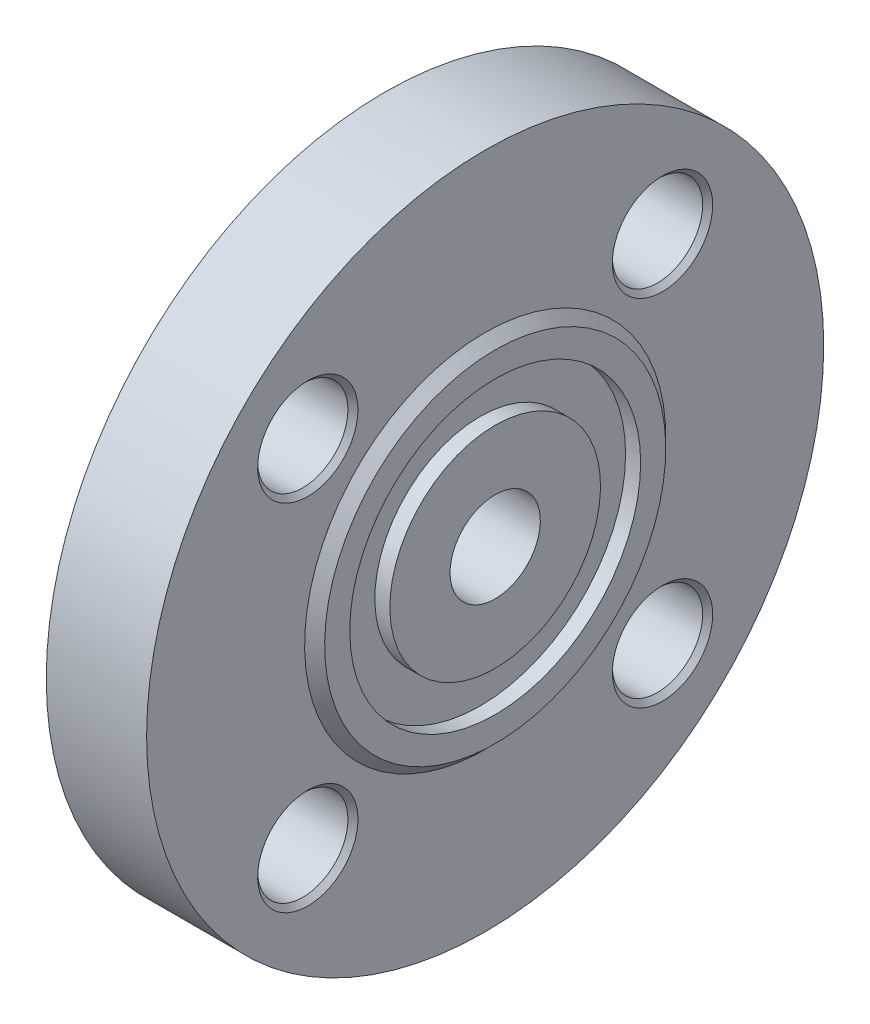
from build123d import *

# Parameters (mm, degrees)
SKETCH_3_R                           = 9.000000000000004
CUT_EXTRUDE_1_DEPTH                  = 112.43944544011336
CHAMFER_1_SIZE                       = 1
PATTERN_CIRCULAR_1_COUNT             = 4
CHAMFER_1_OF_PATTERN_CIRCULAR_1_SIZE = 1


with BuildPart() as part:
    # Эскиз1 → Повернуть1 (revolve)
    with BuildSketch(Plane.XY):
        with BuildLine():
            Line((3.06e-15, 9), (-59.50000000000001, 8.999999999999993))
            Line((-59.50000000000001, 8.999999999999993), (-59.50000000000001, 10.999999999999996))
            Line((-59.50000000000001, 10.999999999999996), (-50.5, 10.999999999999995))
            Line((-50.5, 10.999999999999995), (-47.09683777000456, 15.860219355388013))
            Line((-47.09683777000456, 15.860219355388013), (-25.126967032920497, 24.736623311378192))
            ThreePointArc((-25.126967032920497, 24.736623311378192), (-22.85481213722481, 26.576578066858403), (-22.000000000000007, 29.372542584212177))
            Line((-22.000000000000007, 29.372542584212177), (-22.000000000000007, 67.5))
            Line((-22.000000000000007, 67.5), (-2.0000000000000053, 67.5))
            Line((-2.0000000000000053, 67.5), (-2.0000000000000004, 36.00000000000003))
            Line((-2.0000000000000004, 36.00000000000003), (-6.7e-16, 34))
            Line((-6.7e-16, 34), (6.1e-16, 29))
            Line((6.1e-16, 29), (-2.999999999999999, 29))
            Line((-2.999999999999999, 29), (-2.9999999999999982, 21))
            Line((-2.9999999999999982, 21), (1.73e-15, 21))
            Line((1.73e-15, 21), (3.06e-15, 9))
        make_face()
    revolve(axis=Axis((0, 0, 0), (-1, -1.2e-16, 0)))

    # Эскиз2 → Повернуть2 (revolve)
    with BuildSketch(Plane.XY, mode=Mode.PRIVATE) as revolve_2_sk:
        with BuildLine():
            Line((-47.09683777000456, 15.86021935538801), (-50.5, 10.999999999999991))
            Line((-50.5, 10.999999999999991), (-50.5, 15.999999999999993))
            Line((-50.5, 15.999999999999993), (-47.722770079851955, 15.999999999999993))
            ThreePointArc((-47.722770079851955, 15.999999999999993), (-46.76872510296925, 16.09186408276167), (-45.849737112772424, 16.364080727166044))
            Line((-45.849737112772424, 16.364080727166044), (-47.09683777000456, 15.86021935538801))
        make_face()
    revolve(revolve_2_sk.sketch.rotate(Axis((0, 0, 0), (-1, 0, 0)), 90), axis=Axis((0, 0, 0), (-1, 0, 0)))

    # Эскиз3 → Вырез-Вытянуть1 (cut, through all)
    with BuildSketch(Plane(origin=(-1.9999999999999962, -2.4e-16, 0), x_dir=(0, 0, -1), z_dir=(1, 1.2e-16, 0))):
        with Locations(Location((35.35533905932718, 35.35533905932757, 0), (0, 0, 90))):
            Circle(SKETCH_3_R)
    cut_extrude_1 = extrude(amount=-CUT_EXTRUDE_1_DEPTH, mode=Mode.SUBTRACT)

    # Фаска1
    chamfer_1_edges = [part.edges().sort_by_distance(p)[0] for p in [
        (-22.000000000000007, 26.355339059327566, -35.35533905932718),
        (-1.9999999999999996, 26.355339059327566, -35.35533905932718),
    ]]
    chamfer(chamfer_1_edges, length=CHAMFER_1_SIZE)

    # Круговой массив1: Вырез-Вытянуть1 ×4 about axis
    pattern_circular_1_axis = Axis((0, 6.014e-14, 6.245e-14), (1, 0, 0))
    for i in range(1, PATTERN_CIRCULAR_1_COUNT):
        add(cut_extrude_1.rotate(pattern_circular_1_axis, i * 360 / PATTERN_CIRCULAR_1_COUNT), mode=Mode.SUBTRACT)

    # Фаска1 of Круговой массив1
    chamfer_1_of_pattern_circular_1_edges = [part.edges().sort_by_distance(p)[0] for p in [
        (-22.000000000000007, 35.3553390593273, 26.355339059327566),
        (-1.9999999999999996, 35.3553390593273, 26.355339059327566),
        (-22.000000000000007, -26.35533905932744, 35.35533905932731),
        (-1.9999999999999996, -26.35533905932744, 35.35533905932731),
        (-22.000000000000007, -35.355339059327186, -26.355339059327434),
        (-1.9999999999999996, -35.355339059327186, -26.355339059327434),
    ]]
    chamfer(chamfer_1_of_pattern_circular_1_edges, length=CHAMFER_1_OF_PATTERN_CIRCULAR_1_SIZE)


solid = part.part
